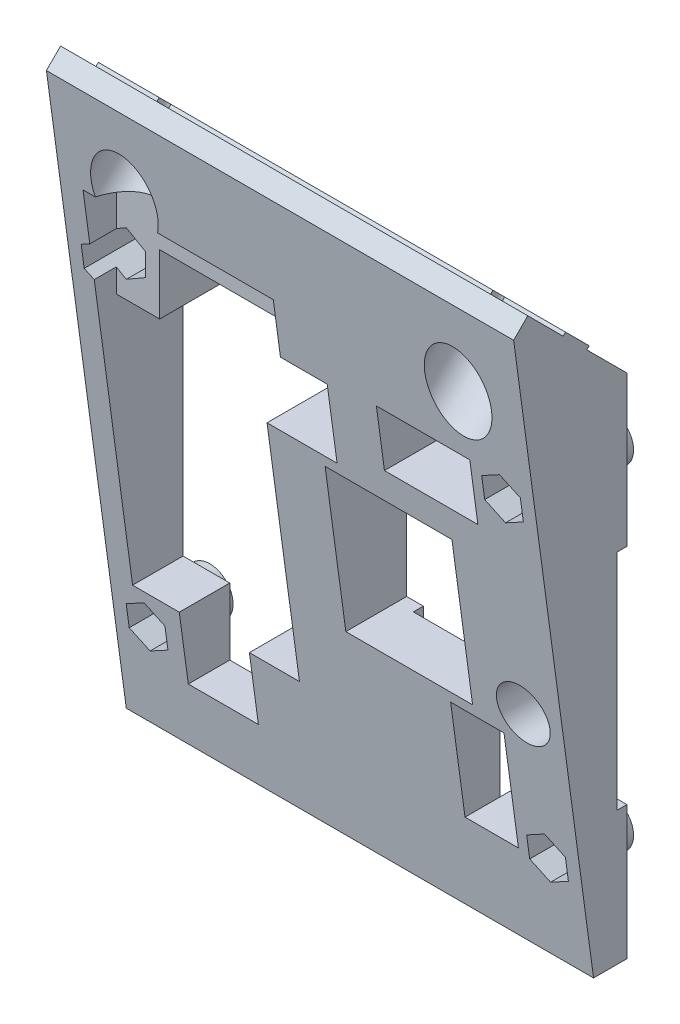
from build123d import *

# Parameters (mm, degrees)
EXTRUDE_1_DEPTH     = 90
SKETCH_2_R          = 1.75
CUT_EXTRUDE_1_DEPTH = 130.002266823
SKETCH_3_R          = 4
SKETCH_3_W          = 25
SKETCH_3_H          = 39
SKETCH_3_W_2        = 10.5
SKETCH_3_H_2        = 10
SKETCH_3_W_3        = 22
SKETCH_3_H_3        = 11
SKETCH_3_W_4        = 11
SKETCH_3_W_5        = 14
SKETCH_3_H_4        = 9
SKETCH_3_W_6        = 9.5
SKETCH_3_H_5        = 42
SKETCH_3_W_7        = 8
SKETCH_3_H_6        = 16
SKETCH_3_W_8        = 19
SKETCH_3_H_7        = 23
CUT_EXTRUDE_2_DEPTH = 130.002266823
CUT_EXTRUDE_3_REACH = 133.002
CUT_EXTRUDE_START   = -2
CUT_EXTRUDE_4_DEPTH = 1.5
SKETCH_6_W          = 90
SKETCH_6_H          = 5
EXTRUDE_2_DEPTH     = 0.5
SKETCH_7_R          = 2.65
CUT_EXTRUDE_5_DEPTH = 118.968449984
CUT_EXTRUDE_6_REACH = 123.968
CUT_EXTRUDE_START_2 = -4
SKETCH_8_R          = 5
SKETCH_9_R          = 3.5
EXTRUDE_3_DEPTH     = 2.5
SKETCH_10_R         = 1.75
CUT_EXTRUDE_7_DEPTH = 130.354890357
CUT_EXTRUDE_8_REACH = 141.002
CUT_EXTRUDE_START_3 = -10
SKETCH_11_W         = 28.5
SKETCH_11_H         = 18
SKETCH_12_W         = 10
SKETCH_12_H         = 98.345155262
SKETCH_12_H_2       = 101.038352977
CUT_EXTRUDE_9_DEPTH = 129.917968218


with BuildPart() as part:
    # 草图1 → 凸台-拉伸1 (new body)
    with BuildSketch(Plane(origin=(0, 0, 0), x_dir=(0, 0, -1), z_dir=(1, 0, 0))):
        Polygon((0, 0), (0, 76), (-14.849242405, 90.849242405), (-16.970562748, 88.727922061), (-5, 0), align=None)
    extrude(amount=EXTRUDE_1_DEPTH)

    # 草图2 → 切除-拉伸1 (cut, through all)
    with BuildSketch(Plane(origin=(0, 0, 0), x_dir=(-1, 0, 0), z_dir=(0, 0, -1))):
        with Locations((-75, 64)):
            Circle(SKETCH_2_R)
        with Locations((-15, 64)):
            Circle(SKETCH_2_R)
        with Locations((-15, 14)):
            Circle(SKETCH_2_R)
        with Locations((-75, 14)):
            Circle(SKETCH_2_R)
    extrude(amount=-CUT_EXTRUDE_1_DEPTH, mode=Mode.SUBTRACT)

    # 草图3 → 切除-拉伸2 (cut, through all)
    with BuildSketch(Plane(origin=(0, 0, 0), x_dir=(-1, 0, 0), z_dir=(0, 0, -1))):
        with Locations((-74, 33.5)):
            Circle(SKETCH_3_R)
        with Locations((-26, 38.5)):
            Rectangle(SKETCH_3_W, SKETCH_3_H)
        with Locations((-25.75, 14)):
            Rectangle(SKETCH_3_W_2, SKETCH_3_H_2)
        with Locations((-31, 61.5)):
            Rectangle(SKETCH_3_W_3, SKETCH_3_H_3)
        with Locations((-43.5, 60.5)):
            Rectangle(SKETCH_3_W_4, SKETCH_3_H_3)
        with Locations((-63.5, 62.5)):
            Rectangle(SKETCH_3_W_5, SKETCH_3_H_4)
        with Locations((-85.25, 34)):
            Rectangle(SKETCH_3_W_6, SKETCH_3_H_5)
        with Locations((-66.5, 21)):
            Rectangle(SKETCH_3_W_7, SKETCH_3_H_6)
        with Locations((-56.5, 42)):
            Rectangle(SKETCH_3_W_8, SKETCH_3_H_7)
    extrude(amount=-CUT_EXTRUDE_2_DEPTH, mode=Mode.SUBTRACT)

    # 切除-拉伸3: up to this plane
    cut_extrude_3_end = Plane(origin=(90, 88.727922061, 16.970562748), z_dir=(0, 0.13370183830700452, -0.9910216034140364))
    # 草图4 → 切除-拉伸3 (cut, up to the surface)
    with BuildSketch(Plane(origin=(0, 0, 0), x_dir=(-1, 0, 0), z_dir=(0, 0, -1)).offset(CUT_EXTRUDE_START), mode=Mode.PRIVATE) as cut_extrude_3_sk1:
        Polygon((-75, 60.651368439), (-72.1, 62.325684219), (-72.1, 65.674315781), (-75, 67.348631561), (-77.9, 65.674315781), (-77.9, 62.325684219), align=None)
    cut_extrude_3_tool1 = split(extrude(cut_extrude_3_sk1.sketch, amount=-CUT_EXTRUDE_3_REACH, mode=Mode.PRIVATE), bisect_by=cut_extrude_3_end, keep=Keep.BOTH, mode=Mode.PRIVATE)
    add(cut_extrude_3_tool1.solids().sort_by_distance((75, 64, 2))[0], mode=Mode.SUBTRACT)
    # 草图4 → 切除-拉伸3 (cut, up to the surface)
    with BuildSketch(Plane(origin=(0, 0, 0), x_dir=(-1, 0, 0), z_dir=(0, 0, -1)).offset(CUT_EXTRUDE_START), mode=Mode.PRIVATE) as cut_extrude_3_sk2:
        Polygon((-15, 60.651368439), (-12.1, 62.325684219), (-12.1, 65.674315781), (-15, 67.348631561), (-17.9, 65.674315781), (-17.9, 62.325684219), align=None)
    cut_extrude_3_tool2 = split(extrude(cut_extrude_3_sk2.sketch, amount=-CUT_EXTRUDE_3_REACH, mode=Mode.PRIVATE), bisect_by=cut_extrude_3_end, keep=Keep.BOTH, mode=Mode.PRIVATE)
    add(cut_extrude_3_tool2.solids().sort_by_distance((15, 64, 2))[0], mode=Mode.SUBTRACT)
    # 草图4 → 切除-拉伸3 (cut, up to the surface)
    with BuildSketch(Plane(origin=(0, 0, 0), x_dir=(-1, 0, 0), z_dir=(0, 0, -1)).offset(CUT_EXTRUDE_START), mode=Mode.PRIVATE) as cut_extrude_3_sk3:
        Polygon((-15, 10.651368439), (-12.1, 12.325684219), (-12.1, 15.674315781), (-15, 17.348631561), (-17.9, 15.674315781), (-17.9, 12.325684219), align=None)
    cut_extrude_3_tool3 = split(extrude(cut_extrude_3_sk3.sketch, amount=-CUT_EXTRUDE_3_REACH, mode=Mode.PRIVATE), bisect_by=cut_extrude_3_end, keep=Keep.BOTH, mode=Mode.PRIVATE)
    add(cut_extrude_3_tool3.solids().sort_by_distance((15, 14, 2))[0], mode=Mode.SUBTRACT)
    # 草图4 → 切除-拉伸3 (cut, up to the surface)
    with BuildSketch(Plane(origin=(0, 0, 0), x_dir=(-1, 0, 0), z_dir=(0, 0, -1)).offset(CUT_EXTRUDE_START), mode=Mode.PRIVATE) as cut_extrude_3_sk4:
        Polygon((-75, 10.651368439), (-72.1, 12.325684219), (-72.1, 15.674315781), (-75, 17.348631561), (-77.9, 15.674315781), (-77.9, 12.325684219), align=None)
    cut_extrude_3_tool4 = split(extrude(cut_extrude_3_sk4.sketch, amount=-CUT_EXTRUDE_3_REACH, mode=Mode.PRIVATE), bisect_by=cut_extrude_3_end, keep=Keep.BOTH, mode=Mode.PRIVATE)
    add(cut_extrude_3_tool4.solids().sort_by_distance((75, 14, 2))[0], mode=Mode.SUBTRACT)

    # 草图5 → 切除-拉伸4 (cut)
    with BuildSketch(Plane(origin=(0, 0, 0), x_dir=(-1, 0, 0), z_dir=(0, 0, -1))):
        Polygon((-70.5, 20), (-70.5, 29), (-62.5, 29), (-62.5, 0), (-49.5, 0), (-49.5, 30.5), (-66, 30.5), (-66, 53.5), (-80.5, 53.5), (-80.5, 20), align=None)
    extrude(amount=-CUT_EXTRUDE_4_DEPTH, mode=Mode.SUBTRACT)

    # 草图6 → 凸台-拉伸2 (add)
    with BuildSketch(Plane(origin=(0, 38, -38), x_dir=(1, 0, 0), z_dir=(0, 0.7071067811865482, -0.7071067811865468))):
        with Locations((45, -64.74011537)):
            Rectangle(SKETCH_6_W, SKETCH_6_H)
    extrude(amount=EXTRUDE_2_DEPTH)

    # 草图7 → 切除-拉伸5 (cut, through all)
    with BuildSketch(Plane(origin=(0, 38.353553391, -38.353553391), x_dir=(1, 0, 0), z_dir=(0, 0.7071067811865489, -0.7071067811865461))):
        with Locations(Location((20, -64.74011537, 0), (0, 0, 270))):
            Circle(SKETCH_7_R)
        with Locations(Location((70, -64.74011537, 0), (0, 0, 270))):
            Circle(SKETCH_7_R)
    extrude(amount=-CUT_EXTRUDE_5_DEPTH, mode=Mode.SUBTRACT)

    # 切除-拉伸6: up to this plane
    cut_extrude_6_end = Plane(origin=(90, 88.727922061, 16.970562748), z_dir=(0, 0.13370183830700452, -0.9910216034140364))
    # 草图8 → 切除-拉伸6 (cut, up to the surface)
    with BuildSketch(Plane(origin=(0, 38.353553391, -38.353553391), x_dir=(1, 0, 0), z_dir=(0, 0.7071067811865489, -0.7071067811865461)).offset(CUT_EXTRUDE_START_2), mode=Mode.PRIVATE) as cut_extrude_6_sk1:
        with Locations(Location((20, -64.74011537, 0), (0, 0, 270))):
            Circle(SKETCH_8_R)
    cut_extrude_6_tool1 = split(extrude(cut_extrude_6_sk1.sketch, amount=-CUT_EXTRUDE_6_REACH, mode=Mode.PRIVATE), bisect_by=cut_extrude_6_end, keep=Keep.BOTH, mode=Mode.PRIVATE)
    add(cut_extrude_6_tool1.solids().sort_by_distance((20, 81.303301, 10.253048))[0], mode=Mode.SUBTRACT)
    # 草图8 → 切除-拉伸6 (cut, up to the surface)
    with BuildSketch(Plane(origin=(0, 38.353553391, -38.353553391), x_dir=(1, 0, 0), z_dir=(0, 0.7071067811865489, -0.7071067811865461)).offset(CUT_EXTRUDE_START_2), mode=Mode.PRIVATE) as cut_extrude_6_sk2:
        with Locations(Location((70, -64.74011537, 0), (0, 0, 270))):
            Circle(SKETCH_8_R)
    cut_extrude_6_tool2 = split(extrude(cut_extrude_6_sk2.sketch, amount=-CUT_EXTRUDE_6_REACH, mode=Mode.PRIVATE), bisect_by=cut_extrude_6_end, keep=Keep.BOTH, mode=Mode.PRIVATE)
    add(cut_extrude_6_tool2.solids().sort_by_distance((70, 81.303301, 10.253048))[0], mode=Mode.SUBTRACT)

    # 草图9 → 凸台-拉伸3 (add)
    with BuildSketch(Plane(origin=(0, 0, 0), x_dir=(-1, 0, 0), z_dir=(0, 0, -1))):
        with Locations(Location((-75, 64, 0), (0, 0, 180))):
            Circle(SKETCH_9_R)
        with Locations(Location((-15, 64, 0), (0, 0, 180))):
            Circle(SKETCH_9_R)
        with Locations(Location((-15, 14, 0), (0, 0, 180))):
            Circle(SKETCH_9_R)
        with Locations(Location((-75, 14, 0), (0, 0, 180))):
            Circle(SKETCH_9_R)
    extrude(amount=EXTRUDE_3_DEPTH)

    # 草图10 → 切除-拉伸7 (cut, through all)
    with BuildSketch(Plane(origin=(0, 0, -2.5), x_dir=(-1, 0, 0), z_dir=(0, 0, -1))):
        with Locations((-75, 14)):
            Circle(SKETCH_10_R)
        with Locations((-15, 14)):
            Circle(SKETCH_10_R)
        with Locations((-15, 64)):
            Circle(SKETCH_10_R)
        with Locations((-75, 64)):
            Circle(SKETCH_10_R)
    extrude(amount=-CUT_EXTRUDE_7_DEPTH, mode=Mode.SUBTRACT)

    # 草图11 → 切除-拉伸8 (cut, up to next)
    with BuildSketch(Plane(origin=(0, 0, 0), x_dir=(-1, 0, 0), z_dir=(0, 0, -1)).offset(CUT_EXTRUDE_START_3), mode=Mode.PRIVATE) as cut_extrude_8_sk1:
        with Locations((-27.75, 65)):
            Rectangle(SKETCH_11_W, SKETCH_11_H)
    cut_extrude_8_tool1 = extrude(cut_extrude_8_sk1.sketch, amount=-CUT_EXTRUDE_8_REACH, mode=Mode.PRIVATE) & part.part
    add(cut_extrude_8_tool1.solids().sort_by_distance((27.75, 65, 10))[0], mode=Mode.SUBTRACT)

    # 草图12 → 切除-拉伸9 (cut, through all)
    with BuildSketch(Plane(origin=(0, -0.662507051, 4.910619092), x_dir=(1, 0, 0), z_dir=(0, -0.13370183830700455, 0.9910216034140364))):
        with Locations((5, 45.332571267)):
            Rectangle(SKETCH_12_W, SKETCH_12_H)
        with Locations((85, 43.98597241)):
            Rectangle(SKETCH_12_W, SKETCH_12_H_2)
    extrude(amount=-CUT_EXTRUDE_9_DEPTH, mode=Mode.SUBTRACT)


solid = part.part
